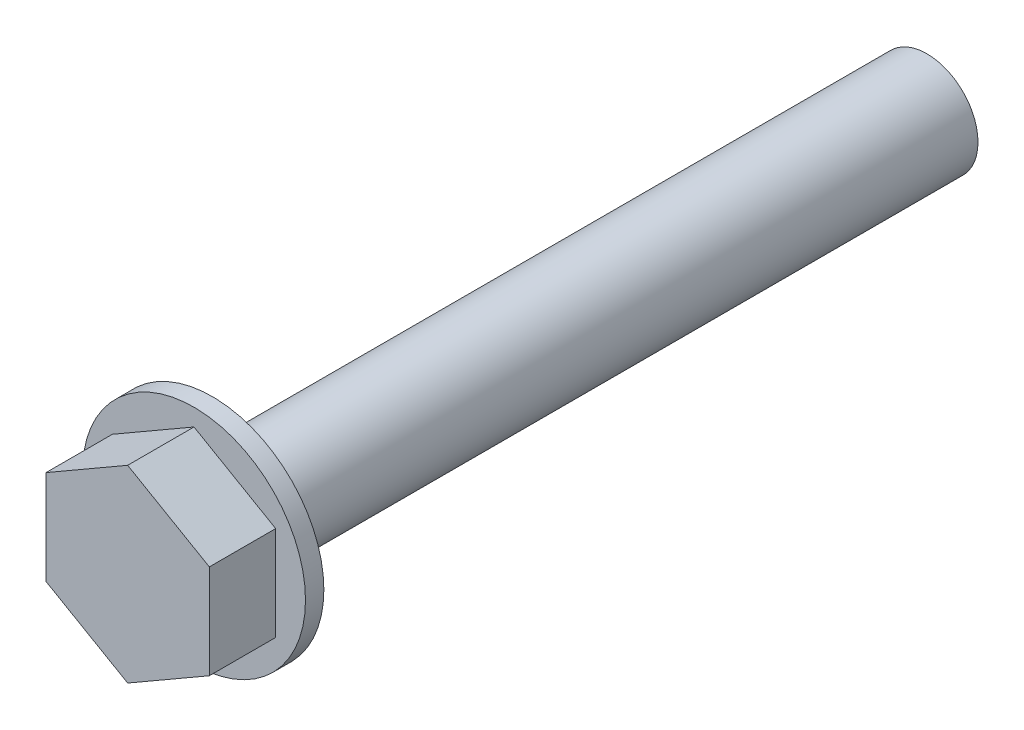
from build123d import *

# Parameters (mm, degrees)
EXTRUDE_SKETCH_1_R = 10.92
EXTRUDE_1_DEPTH    = 1.8
EXTRUDE_START      = 1.8
EXTRUDE_2_DEPTH    = 6.5
EXTRUDE_START_2    = -70
EXTRUDE_SKETCH_3_R = 5
EXTRUDE_3_DEPTH    = 70.01


with BuildPart() as part:
    # Extrude sketch 1 → Extrude 1 (new body)
    with BuildSketch(Plane.XY):
        Circle(EXTRUDE_SKETCH_1_R)
    extrude(amount=EXTRUDE_1_DEPTH)


with BuildPart() as body_2:
    # Extrude sketch 2 → Extrude 2 (new body)
    with BuildSketch(Plane.XY.offset(EXTRUDE_START)):
        Polygon((8, 4.618802154), (0, 9.237604307), (-8, 4.618802154), (-8, -4.618802154), (0, -9.237604307), (8, -4.618802154), align=None)
    extrude(amount=EXTRUDE_2_DEPTH)


with BuildPart() as body_3:
    # Extrude sketch 3 → Extrude 3 (new body)
    with BuildSketch(Plane.XY.offset(EXTRUDE_START_2)):
        Circle(EXTRUDE_SKETCH_3_R)
    extrude(amount=EXTRUDE_3_DEPTH)


with BuildPart() as part_1:
    add(part.part)

    # Combine (weld / assembly of features): union body 3, body 2
    add(body_3.part)
    add(body_2.part)


solid = part_1.part
